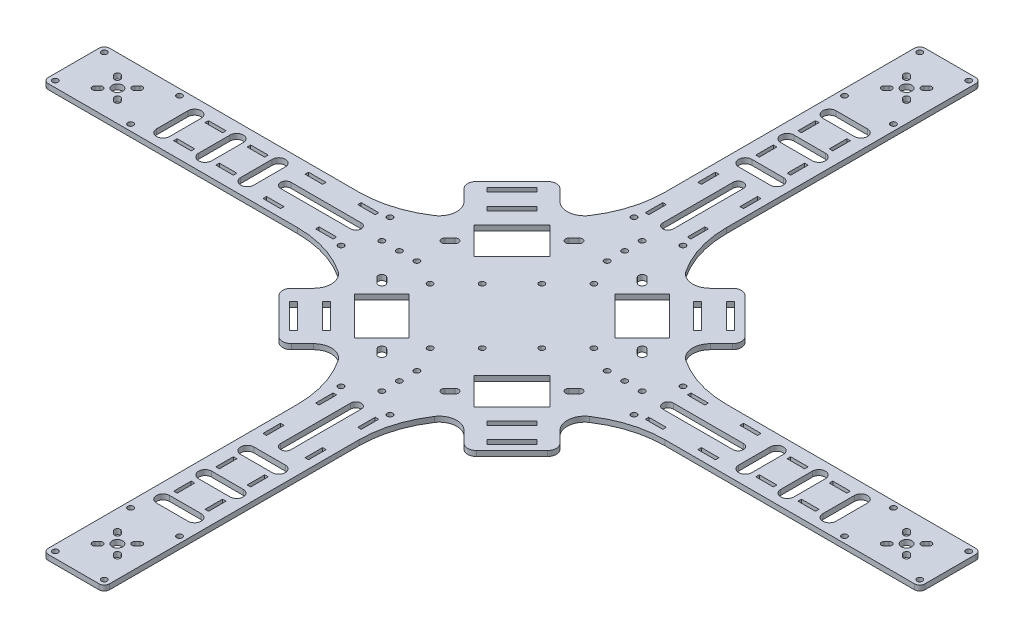
from build123d import *

# Parameters (mm, degrees)
SKETCH_234_R             = 1.6
SKETCH_234_R_2           = 3
SKETCH_234_W             = 2
SKETCH_234_H             = 10
SKETCH_234_W_2           = 10
SKETCH_234_H_2           = 2
EXTRUDE_1_DEPTH          = 3
CUT_EXTRUDE_1_DEPTH      = 537.78114721
CUT_EXTRUDE_1_DEPTH_BACK = 10
SKETCH_2_R               = 1.6
FILLET_1_R               = 3
FILLET_2_R               = 5
CUT_EXTRUDE_2_DEPTH      = 537.78114721
CUT_EXTRUDE_2_DEPTH_BACK = 10


with BuildPart() as part:
    # Sketch 234 → 凸台-拉伸1 (new body)
    with BuildSketch(Plane(origin=(0, 0, 0), x_dir=(1, 0, 0), z_dir=(0, 1, 0))):
        with BuildLine():
            Line((17.5, 25), (-17.5, 25))
            Line((-17.5, 25), (-17.5, -25))
            Line((-17.5, -25), (-17.5, -120.147186258))
            ThreePointArc((-17.5, -120.147186258), (-20.040144251, -137.420430809), (-27.445499244, -153.231124265))
            ThreePointArc((-27.445499244, -153.231124265), (-34.782826417, -157.666496127), (-42.858983849, -154.788202409))
            Line((-42.858983849, -154.788202409), (-52.751262658, -144.895923599))
            Line((-52.751262658, -144.895923599), (-80.104076401, -172.248737342))
            Line((-80.104076401, -172.248737342), (-70.211797591, -182.141016151))
            ThreePointArc((-70.211797591, -182.141016151), (-67.333503873, -190.217173583), (-71.768875735, -197.554500756))
            ThreePointArc((-71.768875735, -197.554500756), (-87.579569191, -204.959855749), (-104.852813742, -207.5))
            Line((-104.852813742, -207.5), (-200, -207.5))
            Line((-200, -207.5), (-250, -207.5))
            Line((-250, -207.5), (-250, -242.5))
            Line((-250, -242.5), (-200, -242.5))
            Line((-200, -242.5), (-104.852813742, -242.5))
            ThreePointArc((-104.852813742, -242.5), (-87.579569191, -245.040144251), (-71.768875735, -252.445499244))
            ThreePointArc((-71.768875735, -252.445499244), (-67.333503873, -259.782826417), (-70.211797591, -267.858983849))
            Line((-70.211797591, -267.858983849), (-80.104076401, -277.751262658))
            Line((-80.104076401, -277.751262658), (-52.751262658, -305.104076401))
            Line((-52.751262658, -305.104076401), (-42.858983849, -295.211797591))
            ThreePointArc((-42.858983849, -295.211797591), (-34.782826417, -292.333503873), (-27.445499244, -296.768875735))
            ThreePointArc((-27.445499244, -296.768875735), (-20.040144251, -312.579569191), (-17.5, -329.852813742))
            Line((-17.5, -329.852813742), (-17.5, -425))
            Line((-17.5, -425), (-17.5, -475))
            Line((-17.5, -475), (17.5, -475))
            Line((17.5, -475), (17.5, -425))
            Line((17.5, -425), (17.5, -329.852813742))
            ThreePointArc((17.5, -329.852813742), (20.040144251, -312.579569191), (27.445499244, -296.768875735))
            ThreePointArc((27.445499244, -296.768875735), (34.782826417, -292.333503873), (42.858983849, -295.211797591))
            Line((42.858983849, -295.211797591), (52.751262658, -305.104076401))
            Line((52.751262658, -305.104076401), (80.104076401, -277.751262658))
            Line((80.104076401, -277.751262658), (70.211797591, -267.858983849))
            ThreePointArc((70.211797591, -267.858983849), (67.333503873, -259.782826417), (71.768875735, -252.445499244))
            ThreePointArc((71.768875735, -252.445499244), (87.579569191, -245.040144251), (104.852813742, -242.5))
            Line((104.852813742, -242.5), (200, -242.5))
            Line((200, -242.5), (250, -242.5))
            Line((250, -242.5), (250, -207.5))
            Line((250, -207.5), (200, -207.5))
            Line((200, -207.5), (104.852813742, -207.5))
            ThreePointArc((104.852813742, -207.5), (87.579569191, -204.959855749), (71.768875735, -197.554500756))
            ThreePointArc((71.768875735, -197.554500756), (67.333503873, -190.217173583), (70.211797591, -182.141016151))
            Line((70.211797591, -182.141016151), (80.104076401, -172.248737342))
            Line((80.104076401, -172.248737342), (52.751262658, -144.895923599))
            Line((52.751262658, -144.895923599), (42.858983849, -154.788202409))
            ThreePointArc((42.858983849, -154.788202409), (34.782826417, -157.666496127), (27.445499244, -153.231124265))
            ThreePointArc((27.445499244, -153.231124265), (20.040144251, -137.420430809), (17.5, -120.147186258))
            Line((17.5, -120.147186258), (17.5, -25))
            Line((17.5, -25), (17.5, 25))
        make_face()
        with Locations((-13.964466094, -471.464466094)):
            Circle(SKETCH_234_R, mode=Mode.SUBTRACT)
        with BuildLine():
            ThreePointArc((-6.081118318, -453.818376618), (-3.818376618, -453.818376618), (-3.818376618, -456.081118318))
            Line((-3.818376618, -456.081118318), (-5.232590181, -457.495331881))
            ThreePointArc((-5.232590181, -457.495331881), (-7.495331881, -457.495331881), (-7.495331881, -455.232590181))
            Line((-7.495331881, -455.232590181), (-6.081118318, -453.818376618))
        make_face(mode=Mode.SUBTRACT)
        with Locations((0, -450)):
            Circle(SKETCH_234_R_2, mode=Mode.SUBTRACT)
        with BuildLine():
            ThreePointArc((-3.818376618, -443.918881682), (-3.818376618, -446.181623382), (-6.081118318, -446.181623382))
            Line((-6.081118318, -446.181623382), (-7.495331881, -444.767409819))
            ThreePointArc((-7.495331881, -444.767409819), (-7.495331881, -442.504668119), (-5.232590181, -442.504668119))
            Line((-5.232590181, -442.504668119), (-3.818376618, -443.918881682))
        make_face(mode=Mode.SUBTRACT)
        with Locations((-13.964466094, -428.535533906)):
            Circle(SKETCH_234_R, mode=Mode.SUBTRACT)
        with BuildLine():
            ThreePointArc((-9, -418.75), (-12.75, -415), (-9, -411.25))
            Line((-9, -411.25), (9, -411.25))
            ThreePointArc((9, -411.25), (12.75, -415), (9, -418.75))
            Line((9, -418.75), (0, -418.75))
            Line((0, -418.75), (-9, -418.75))
        make_face(mode=Mode.SUBTRACT)
        Polygon((-7.93903755, -408), (-9, -408), (-9.93903755, -408), (-9.93903755, -398), (-9, -398), (-7.93903755, -398), align=None, mode=Mode.SUBTRACT)
        with Locations((-8.93903755, -378.95882731)):
            Rectangle(SKETCH_234_W, SKETCH_234_H, mode=Mode.SUBTRACT)
        with BuildLine():
            ThreePointArc((-244.864466094, -238.964466094), (-245.852172602, -240.442673346), (-247.595836944, -240.095836944))
            ThreePointArc((-247.595836944, -240.095836944), (-247.076759586, -237.486258842), (-244.864466094, -238.964466094))
        make_face(mode=Mode.SUBTRACT)
        with BuildLine():
            ThreePointArc((-231.081118318, -228.818376618), (-228.818376618, -228.818376618), (-228.818376618, -231.081118318))
            Line((-228.818376618, -231.081118318), (-230.232590181, -232.495331881))
            ThreePointArc((-230.232590181, -232.495331881), (-232.495331881, -232.495331881), (-232.495331881, -230.232590181))
            Line((-232.495331881, -230.232590181), (-231.081118318, -228.818376618))
        make_face(mode=Mode.SUBTRACT)
        with BuildLine():
            ThreePointArc((-221.181623382, -231.081118318), (-221.181623382, -228.818376618), (-218.918881682, -228.818376618))
            Line((-218.918881682, -228.818376618), (-217.504668119, -230.232590181))
            ThreePointArc((-217.504668119, -230.232590181), (-217.504668119, -232.495331881), (-219.767409819, -232.495331881))
            Line((-219.767409819, -232.495331881), (-221.181623382, -231.081118318))
        make_face(mode=Mode.SUBTRACT)
        with Locations((-203.535533906, -238.964466094)):
            Circle(SKETCH_234_R, mode=Mode.SUBTRACT)
        with Locations((-178, -233.93903755)):
            Rectangle(SKETCH_234_W_2, SKETCH_234_H_2, mode=Mode.SUBTRACT)
        with Locations((-153.95882731, -233.93903755)):
            Rectangle(SKETCH_234_W_2, SKETCH_234_H_2, mode=Mode.SUBTRACT)
        with Locations((-12, -349)):
            Rectangle(SKETCH_234_W, SKETCH_234_H, mode=Mode.SUBTRACT)
        with Locations((-12, -319)):
            Rectangle(SKETCH_234_W, SKETCH_234_H, mode=Mode.SUBTRACT)
        with Locations((-13.964466094, -308.535533906)):
            Circle(SKETCH_234_R, mode=Mode.SUBTRACT)
        with Locations((-124, -237)):
            Rectangle(SKETCH_234_W_2, SKETCH_234_H_2, mode=Mode.SUBTRACT)
        with Locations((-94, -237)):
            Rectangle(SKETCH_234_W_2, SKETCH_234_H_2, mode=Mode.SUBTRACT)
        with BuildLine():
            ThreePointArc((-89, -222), (-86, -225), (-89, -228))
            Line((-89, -228), (-129, -228))
            ThreePointArc((-129, -228), (-132, -225), (-129, -222))
            Line((-129, -222), (-89, -222))
        make_face(mode=Mode.SUBTRACT)
        with Locations((-83.535533906, -238.964466094)):
            Circle(SKETCH_234_R, mode=Mode.SUBTRACT)
        with BuildLine():
            ThreePointArc((15.564466094, -471.464466094), (15.442673346, -472.076759586), (15.095836944, -472.595836944))
            ThreePointArc((15.095836944, -472.595836944), (12.486258842, -470.852172602), (15.564466094, -471.464466094))
        make_face(mode=Mode.SUBTRACT)
        with BuildLine():
            ThreePointArc((3.818376618, -456.081118318), (3.818376618, -453.818376618), (6.081118318, -453.818376618))
            Line((6.081118318, -453.818376618), (7.495331881, -455.232590181))
            ThreePointArc((7.495331881, -455.232590181), (7.495331881, -457.495331881), (5.232590181, -457.495331881))
            Line((5.232590181, -457.495331881), (3.818376618, -456.081118318))
        make_face(mode=Mode.SUBTRACT)
        with BuildLine():
            ThreePointArc((6.081118318, -446.181623382), (3.818376618, -446.181623382), (3.818376618, -443.918881682))
            Line((3.818376618, -443.918881682), (5.232590181, -442.504668119))
            ThreePointArc((5.232590181, -442.504668119), (7.495331881, -442.504668119), (7.495331881, -444.767409819))
            Line((7.495331881, -444.767409819), (6.081118318, -446.181623382))
        make_face(mode=Mode.SUBTRACT)
        with Locations((13.964466094, -428.535533906)):
            Circle(SKETCH_234_R, mode=Mode.SUBTRACT)
        with Locations((8.93903755, -403)):
            Rectangle(SKETCH_234_W, SKETCH_234_H, mode=Mode.SUBTRACT)
        with BuildLine():
            Line((9, -394.75), (-9, -394.75))
            ThreePointArc((-9, -394.75), (-12.75, -391), (-9, -387.25))
            Line((-9, -387.25), (9, -387.25))
            ThreePointArc((9, -387.25), (12.75, -391), (9, -394.75))
        make_face(mode=Mode.SUBTRACT)
        with Locations((8.93903755, -378.95882731)):
            Rectangle(SKETCH_234_W, SKETCH_234_H, mode=Mode.SUBTRACT)
        with BuildLine():
            ThreePointArc((9, -363.25), (12.75, -367), (9, -370.75))
            Line((9, -370.75), (-9, -370.75))
            ThreePointArc((-9, -370.75), (-12.75, -367), (-9, -363.25))
            Line((-9, -363.25), (9, -363.25))
        make_face(mode=Mode.SUBTRACT)
        with Locations((12, -349)):
            Rectangle(SKETCH_234_W, SKETCH_234_H, mode=Mode.SUBTRACT)
        with BuildLine():
            ThreePointArc((-3, -314), (0, -311), (3, -314))
            Line((3, -314), (3, -354))
            ThreePointArc((3, -354), (0, -357), (-3, -354))
            Line((-3, -354), (-3, -314))
        make_face(mode=Mode.SUBTRACT)
        with Locations((12, -319)):
            Rectangle(SKETCH_234_W, SKETCH_234_H, mode=Mode.SUBTRACT)
        with Locations((13.964466094, -308.535533906)):
            Circle(SKETCH_234_R, mode=Mode.SUBTRACT)
        with Locations((83.535533906, -238.964466094)):
            Circle(SKETCH_234_R, mode=Mode.SUBTRACT)
        with Locations((94, -237)):
            Rectangle(SKETCH_234_W_2, SKETCH_234_H_2, mode=Mode.SUBTRACT)
        with Locations((124, -237)):
            Rectangle(SKETCH_234_W_2, SKETCH_234_H_2, mode=Mode.SUBTRACT)
        with Locations((153.95882731, -233.93903755)):
            Rectangle(SKETCH_234_W_2, SKETCH_234_H_2, mode=Mode.SUBTRACT)
        Polygon((183, -232.93903755), (183, -234), (183, -234.93903755), (173, -234.93903755), (173, -234), (173, -232.93903755), align=None, mode=Mode.SUBTRACT)
        with Locations((203.535533906, -238.964466094)):
            Circle(SKETCH_234_R, mode=Mode.SUBTRACT)
        with BuildLine():
            ThreePointArc((218.918881682, -228.818376618), (221.181623382, -228.818376618), (221.181623382, -231.081118318))
            Line((221.181623382, -231.081118318), (219.767409819, -232.495331881))
            ThreePointArc((219.767409819, -232.495331881), (217.504668119, -232.495331881), (217.504668119, -230.232590181))
            Line((217.504668119, -230.232590181), (218.918881682, -228.818376618))
        make_face(mode=Mode.SUBTRACT)
        with BuildLine():
            ThreePointArc((228.818376618, -231.081118318), (228.818376618, -228.818376618), (231.081118318, -228.818376618))
            Line((231.081118318, -228.818376618), (232.495331881, -230.232590181))
            ThreePointArc((232.495331881, -230.232590181), (232.495331881, -232.495331881), (230.232590181, -232.495331881))
            Line((230.232590181, -232.495331881), (228.818376618, -231.081118318))
        make_face(mode=Mode.SUBTRACT)
        with Locations((246.464466094, -238.964466094)):
            Circle(SKETCH_234_R, mode=Mode.SUBTRACT)
        with Locations((-246.464466094, -211.035533906)):
            Circle(SKETCH_234_R, mode=Mode.SUBTRACT)
        with BuildLine():
            ThreePointArc((-228.818376618, -218.918881682), (-228.818376618, -221.181623382), (-231.081118318, -221.181623382))
            Line((-231.081118318, -221.181623382), (-232.495331881, -219.767409819))
            ThreePointArc((-232.495331881, -219.767409819), (-232.495331881, -217.504668119), (-230.232590181, -217.504668119))
            Line((-230.232590181, -217.504668119), (-228.818376618, -218.918881682))
        make_face(mode=Mode.SUBTRACT)
        with Locations((-225, -225)):
            Circle(SKETCH_234_R_2, mode=Mode.SUBTRACT)
        with BuildLine():
            ThreePointArc((-218.918881682, -221.181623382), (-221.181623382, -221.181623382), (-221.181623382, -218.918881682))
            Line((-221.181623382, -218.918881682), (-219.767409819, -217.504668119))
            ThreePointArc((-219.767409819, -217.504668119), (-217.504668119, -217.504668119), (-217.504668119, -219.767409819))
            Line((-217.504668119, -219.767409819), (-218.918881682, -221.181623382))
        make_face(mode=Mode.SUBTRACT)
        with Locations((-203.535533906, -211.035533906)):
            Circle(SKETCH_234_R, mode=Mode.SUBTRACT)
        with BuildLine():
            ThreePointArc((-193.75, -216), (-190, -212.25), (-186.25, -216))
            Line((-186.25, -216), (-186.25, -234))
            ThreePointArc((-186.25, -234), (-190, -237.75), (-193.75, -234))
            Line((-193.75, -234), (-193.75, -225))
            Line((-193.75, -225), (-193.75, -216))
        make_face(mode=Mode.SUBTRACT)
        Polygon((-183, -217.06096245), (-183, -216), (-183, -215.06096245), (-173, -215.06096245), (-173, -216), (-173, -217.06096245), align=None, mode=Mode.SUBTRACT)
        with BuildLine():
            Line((-169.75, -234), (-169.75, -216))
            ThreePointArc((-169.75, -216), (-166, -212.25), (-162.25, -216))
            Line((-162.25, -216), (-162.25, -234))
            ThreePointArc((-162.25, -234), (-166, -237.75), (-169.75, -234))
        make_face(mode=Mode.SUBTRACT)
        with BuildLine():
            ThreePointArc((-138.25, -234), (-142, -237.75), (-145.75, -234))
            Line((-145.75, -234), (-145.75, -216))
            ThreePointArc((-145.75, -216), (-142, -212.25), (-138.25, -216))
            Line((-138.25, -216), (-138.25, -234))
        make_face(mode=Mode.SUBTRACT)
        with Locations((-153.95882731, -216.06096245)):
            Rectangle(SKETCH_234_W_2, SKETCH_234_H_2, mode=Mode.SUBTRACT)
        with Locations((-124, -213)):
            Rectangle(SKETCH_234_W_2, SKETCH_234_H_2, mode=Mode.SUBTRACT)
        with Locations((-94, -213)):
            Rectangle(SKETCH_234_W_2, SKETCH_234_H_2, mode=Mode.SUBTRACT)
        with Locations((-83.535533906, -211.035533906)):
            Circle(SKETCH_234_R, mode=Mode.SUBTRACT)
        with Locations((-13.964466094, -141.464466094)):
            Circle(SKETCH_234_R, mode=Mode.SUBTRACT)
        with Locations((-12, -131)):
            Rectangle(SKETCH_234_W, SKETCH_234_H, mode=Mode.SUBTRACT)
        with BuildLine():
            ThreePointArc((3, -136), (0, -139), (-3, -136))
            Line((-3, -136), (-3, -96))
            ThreePointArc((-3, -96), (0, -93), (3, -96))
            Line((3, -96), (3, -136))
        make_face(mode=Mode.SUBTRACT)
        with Locations((-12, -101)):
            Rectangle(SKETCH_234_W, SKETCH_234_H, mode=Mode.SUBTRACT)
        with BuildLine():
            ThreePointArc((-9, -86.75), (-12.75, -83), (-9, -79.25))
            Line((-9, -79.25), (9, -79.25))
            ThreePointArc((9, -79.25), (12.75, -83), (9, -86.75))
            Line((9, -86.75), (-9, -86.75))
        make_face(mode=Mode.SUBTRACT)
        with Locations((-8.93903755, -71.04117269)):
            Rectangle(SKETCH_234_W, SKETCH_234_H, mode=Mode.SUBTRACT)
        with BuildLine():
            Line((-9, -55.25), (9, -55.25))
            ThreePointArc((9, -55.25), (12.75, -59), (9, -62.75))
            Line((9, -62.75), (-9, -62.75))
            ThreePointArc((-9, -62.75), (-12.75, -59), (-9, -55.25))
        make_face(mode=Mode.SUBTRACT)
        with Locations((-8.93903755, -47)):
            Rectangle(SKETCH_234_W, SKETCH_234_H, mode=Mode.SUBTRACT)
        with BuildLine():
            ThreePointArc((-9, -38.75), (-12.75, -35), (-9, -31.25))
            Line((-9, -31.25), (0, -31.25))
            Line((0, -31.25), (9, -31.25))
            ThreePointArc((9, -31.25), (12.75, -35), (9, -38.75))
            Line((9, -38.75), (-9, -38.75))
        make_face(mode=Mode.SUBTRACT)
        with Locations((-13.964466094, -21.464466094)):
            Circle(SKETCH_234_R, mode=Mode.SUBTRACT)
        with BuildLine():
            ThreePointArc((-6.081118318, -3.818376618), (-3.818376618, -3.818376618), (-3.818376618, -6.081118318))
            Line((-3.818376618, -6.081118318), (-5.232590181, -7.495331881))
            ThreePointArc((-5.232590181, -7.495331881), (-7.495331881, -7.495331881), (-7.495331881, -5.232590181))
            Line((-7.495331881, -5.232590181), (-6.081118318, -3.818376618))
        make_face(mode=Mode.SUBTRACT)
        Circle(SKETCH_234_R_2, mode=Mode.SUBTRACT)
        with BuildLine():
            ThreePointArc((-3.818376618, 6.081118318), (-3.818376618, 3.818376618), (-6.081118318, 3.818376618))
            Line((-6.081118318, 3.818376618), (-7.495331881, 5.232590181))
            ThreePointArc((-7.495331881, 5.232590181), (-7.495331881, 7.495331881), (-5.232590181, 7.495331881))
            Line((-5.232590181, 7.495331881), (-3.818376618, 6.081118318))
        make_face(mode=Mode.SUBTRACT)
        with BuildLine():
            ThreePointArc((-12.364466094, 21.464466094), (-14.576759586, 19.986258842), (-15.095836944, 22.595836944))
            ThreePointArc((-15.095836944, 22.595836944), (-13.352172602, 22.942673346), (-12.364466094, 21.464466094))
        make_face(mode=Mode.SUBTRACT)
        with Locations((83.535533906, -211.035533906)):
            Circle(SKETCH_234_R, mode=Mode.SUBTRACT)
        with BuildLine():
            ThreePointArc((89, -228), (86, -225), (89, -222))
            Line((89, -222), (129, -222))
            ThreePointArc((129, -222), (132, -225), (129, -228))
            Line((129, -228), (89, -228))
        make_face(mode=Mode.SUBTRACT)
        with Locations((94, -213)):
            Rectangle(SKETCH_234_W_2, SKETCH_234_H_2, mode=Mode.SUBTRACT)
        with Locations((124, -213)):
            Rectangle(SKETCH_234_W_2, SKETCH_234_H_2, mode=Mode.SUBTRACT)
        with Locations((13.964466094, -141.464466094)):
            Circle(SKETCH_234_R, mode=Mode.SUBTRACT)
        with Locations((12, -131)):
            Rectangle(SKETCH_234_W, SKETCH_234_H, mode=Mode.SUBTRACT)
        with Locations((12, -101)):
            Rectangle(SKETCH_234_W, SKETCH_234_H, mode=Mode.SUBTRACT)
        with BuildLine():
            ThreePointArc((138.25, -216), (142, -212.25), (145.75, -216))
            Line((145.75, -216), (145.75, -234))
            ThreePointArc((145.75, -234), (142, -237.75), (138.25, -234))
            Line((138.25, -234), (138.25, -216))
        make_face(mode=Mode.SUBTRACT)
        with Locations((153.95882731, -216.06096245)):
            Rectangle(SKETCH_234_W_2, SKETCH_234_H_2, mode=Mode.SUBTRACT)
        with BuildLine():
            Line((169.75, -216), (169.75, -234))
            ThreePointArc((169.75, -234), (166, -237.75), (162.25, -234))
            Line((162.25, -234), (162.25, -216))
            ThreePointArc((162.25, -216), (166, -212.25), (169.75, -216))
        make_face(mode=Mode.SUBTRACT)
        with Locations((178, -216.06096245)):
            Rectangle(SKETCH_234_W_2, SKETCH_234_H_2, mode=Mode.SUBTRACT)
        with BuildLine():
            ThreePointArc((193.75, -234), (190, -237.75), (186.25, -234))
            Line((186.25, -234), (186.25, -216))
            ThreePointArc((186.25, -216), (190, -212.25), (193.75, -216))
            Line((193.75, -216), (193.75, -225))
            Line((193.75, -225), (193.75, -234))
        make_face(mode=Mode.SUBTRACT)
        with Locations((203.535533906, -211.035533906)):
            Circle(SKETCH_234_R, mode=Mode.SUBTRACT)
        with Locations((225, -225)):
            Circle(SKETCH_234_R_2, mode=Mode.SUBTRACT)
        with BuildLine():
            ThreePointArc((221.181623382, -218.918881682), (221.181623382, -221.181623382), (218.918881682, -221.181623382))
            Line((218.918881682, -221.181623382), (217.504668119, -219.767409819))
            ThreePointArc((217.504668119, -219.767409819), (217.504668119, -217.504668119), (219.767409819, -217.504668119))
            Line((219.767409819, -217.504668119), (221.181623382, -218.918881682))
        make_face(mode=Mode.SUBTRACT)
        with BuildLine():
            ThreePointArc((231.081118318, -221.181623382), (228.818376618, -221.181623382), (228.818376618, -218.918881682))
            Line((228.818376618, -218.918881682), (230.232590181, -217.504668119))
            ThreePointArc((230.232590181, -217.504668119), (232.495331881, -217.504668119), (232.495331881, -219.767409819))
            Line((232.495331881, -219.767409819), (231.081118318, -221.181623382))
        make_face(mode=Mode.SUBTRACT)
        with BuildLine():
            ThreePointArc((248.064466094, -211.035533906), (244.986258842, -211.647827398), (247.595836944, -209.904163056))
            ThreePointArc((247.595836944, -209.904163056), (247.942673346, -210.423240414), (248.064466094, -211.035533906))
        make_face(mode=Mode.SUBTRACT)
        with Locations((8.93903755, -71.04117269)):
            Rectangle(SKETCH_234_W, SKETCH_234_H, mode=Mode.SUBTRACT)
        Polygon((7.93903755, -42), (9, -42), (9.93903755, -42), (9.93903755, -52), (9, -52), (7.93903755, -52), align=None, mode=Mode.SUBTRACT)
        with Locations((13.964466094, -21.464466094)):
            Circle(SKETCH_234_R, mode=Mode.SUBTRACT)
        with BuildLine():
            ThreePointArc((3.818376618, -6.081118318), (3.818376618, -3.818376618), (6.081118318, -3.818376618))
            Line((6.081118318, -3.818376618), (7.495331881, -5.232590181))
            ThreePointArc((7.495331881, -5.232590181), (7.495331881, -7.495331881), (5.232590181, -7.495331881))
            Line((5.232590181, -7.495331881), (3.818376618, -6.081118318))
        make_face(mode=Mode.SUBTRACT)
        with BuildLine():
            ThreePointArc((6.081118318, 3.818376618), (3.818376618, 3.818376618), (3.818376618, 6.081118318))
            Line((3.818376618, 6.081118318), (5.232590181, 7.495331881))
            ThreePointArc((5.232590181, 7.495331881), (7.495331881, 7.495331881), (7.495331881, 5.232590181))
            Line((7.495331881, 5.232590181), (6.081118318, 3.818376618))
        make_face(mode=Mode.SUBTRACT)
        with Locations((13.964466094, 21.464466094)):
            Circle(SKETCH_234_R, mode=Mode.SUBTRACT)
    extrude(amount=EXTRUDE_1_DEPTH)

    # 草图2 → 切除-拉伸1 (cut, two sides: drawn at the far end of the back side and taken through both)
    with BuildSketch(Plane(origin=(0, 3, 0), x_dir=(1, 0, 0), z_dir=(0, 1, 0)).offset(-CUT_EXTRUDE_1_DEPTH_BACK)):
        Polygon((40.128309832, -243.561553006), (29.344931419, -254.344931419), (18.561553006, -265.128309832), (34.117902192, -280.684659018), (55.684659018, -259.117902192), align=None)
        with Locations((7.424621202, -185.755573644)):
            Circle(SKETCH_2_R)
        with Locations((39.244426356, -217.575378798)):
            Circle(SKETCH_2_R)
        with BuildLine():
            Line((54.800775542, -247.273863607), (57.629202667, -244.445436483))
            ThreePointArc((57.629202667, -244.445436483), (57.629202667, -241.617009358), (54.800775542, -241.617009358))
            Line((54.800775542, -241.617009358), (51.972348417, -244.445436483))
            ThreePointArc((51.972348417, -244.445436483), (51.972348417, -247.273863607), (54.800775542, -247.273863607))
        make_face()
        with BuildLine():
            ThreePointArc((16.617009358, -279.800775542), (16.617009358, -282.629202667), (19.445436483, -282.629202667))
            Line((19.445436483, -282.629202667), (22.273863607, -279.800775542))
            ThreePointArc((22.273863607, -279.800775542), (22.273863607, -276.972348417), (19.445436483, -276.972348417))
            Line((19.445436483, -276.972348417), (16.617009358, -279.800775542))
        make_face()
        with BuildLine():
            Line((-22.273863607, -279.800775542), (-19.445436483, -282.629202667))
            ThreePointArc((-19.445436483, -282.629202667), (-16.617009358, -282.629202667), (-16.617009358, -279.800775542))
            Line((-16.617009358, -279.800775542), (-19.445436483, -276.972348417))
            ThreePointArc((-19.445436483, -276.972348417), (-22.273863607, -276.972348417), (-22.273863607, -279.800775542))
        make_face()
        with BuildLine():
            ThreePointArc((-54.800775542, -241.617009358), (-57.629202667, -241.617009358), (-57.629202667, -244.445436483))
            Line((-57.629202667, -244.445436483), (-54.800775542, -247.273863607))
            ThreePointArc((-54.800775542, -247.273863607), (-51.972348417, -247.273863607), (-51.972348417, -244.445436483))
            Line((-51.972348417, -244.445436483), (-54.800775542, -241.617009358))
        make_face()
        with BuildLine():
            Line((-54.800775542, -202.726136393), (-57.629202667, -205.554563517))
            ThreePointArc((-57.629202667, -205.554563517), (-57.629202667, -208.382990642), (-54.800775542, -208.382990642))
            Line((-54.800775542, -208.382990642), (-51.972348417, -205.554563517))
            ThreePointArc((-51.972348417, -205.554563517), (-51.972348417, -202.726136393), (-54.800775542, -202.726136393))
        make_face()
        with BuildLine():
            ThreePointArc((-16.617009358, -170.199224458), (-16.617009358, -167.370797333), (-19.445436483, -167.370797333))
            Line((-19.445436483, -167.370797333), (-22.273863607, -170.199224458))
            ThreePointArc((-22.273863607, -170.199224458), (-22.273863607, -173.027651583), (-19.445436483, -173.027651583))
            Line((-19.445436483, -173.027651583), (-16.617009358, -170.199224458))
        make_face()
        with BuildLine():
            Line((22.273863607, -170.199224458), (19.445436483, -167.370797333))
            ThreePointArc((19.445436483, -167.370797333), (16.617009358, -167.370797333), (16.617009358, -170.199224458))
            Line((16.617009358, -170.199224458), (19.445436483, -173.027651583))
            ThreePointArc((19.445436483, -173.027651583), (22.273863607, -173.027651583), (22.273863607, -170.199224458))
        make_face()
        with BuildLine():
            ThreePointArc((54.800775542, -208.382990642), (57.629202667, -208.382990642), (57.629202667, -205.554563517))
            Line((57.629202667, -205.554563517), (54.800775542, -202.726136393))
            ThreePointArc((54.800775542, -202.726136393), (51.972348417, -202.726136393), (51.972348417, -205.554563517))
            Line((51.972348417, -205.554563517), (54.800775542, -208.382990642))
        make_face()
        Polygon((-18.561553006, -265.128309832), (-40.128309832, -243.561553006), (-55.684659018, -259.117902192), (-34.117902192, -280.684659018), align=None)
        Polygon((-40.128309832, -206.438446994), (-18.561553006, -184.871690168), (-34.117902192, -169.315340982), (-55.684659018, -190.882097808), align=None)
        Polygon((18.561553006, -184.871690168), (40.128309832, -206.438446994), (55.684659018, -190.882097808), (34.117902192, -169.315340982), align=None)
        with Locations((7.424621202, -249.395183951)):
            Circle(SKETCH_2_R)
        with Locations((-24.395183951, -217.575378798)):
            Circle(SKETCH_2_R)
        with Locations((24.395183951, -232.424621202)):
            Circle(SKETCH_2_R)
        with Locations((-7.424621202, -264.244426356)):
            Circle(SKETCH_2_R)
        with Locations((-39.244426356, -232.424621202)):
            Circle(SKETCH_2_R)
        with Locations((-7.424621202, -200.604816049)):
            Circle(SKETCH_2_R)
        with Locations((0, -150.753787975)):
            Circle(SKETCH_2_R)
        with Locations((0, -160.753787975)):
            Circle(SKETCH_2_R)
        with Locations((0, -170.753787975)):
            Circle(SKETCH_2_R)
        with Locations((74.246212025, -225)):
            Circle(SKETCH_2_R)
        with Locations((64.246212025, -225)):
            Circle(SKETCH_2_R)
        with Locations((54.246212025, -225)):
            Circle(SKETCH_2_R)
        with Locations((0, -299.246212025)):
            Circle(SKETCH_2_R)
        with Locations((0, -289.246212025)):
            Circle(SKETCH_2_R)
        with Locations((0, -279.246212025)):
            Circle(SKETCH_2_R)
        with Locations((-74.246212025, -225)):
            Circle(SKETCH_2_R)
        with Locations((-64.246212025, -225)):
            Circle(SKETCH_2_R)
        with Locations((-54.246212025, -225)):
            Circle(SKETCH_2_R)
    extrude(amount=CUT_EXTRUDE_1_DEPTH + CUT_EXTRUDE_1_DEPTH_BACK, mode=Mode.SUBTRACT)

    # 圆角1
    fillet_1_edges = [part.edges().sort_by_distance(p)[0] for p in [
        (-250, 1.5, 242.5),
        (-250, 1.5, 207.5),
        (250, 1.5, 242.5),
        (250, 1.5, 207.5),
        (-17.5, 1.5, -25),
        (17.5, 1.5, -25),
        (17.5, 1.5, 475),
        (-17.5, 1.5, 475),
    ]]
    fillet(fillet_1_edges, radius=FILLET_1_R)

    # 圆角2
    fillet_2_edges = [part.edges().sort_by_distance(p)[0] for p in [
        (-80.104076401, 1.5, 172.248737342),
        (-52.751262658, 1.5, 144.895923599),
        (52.751262658, 1.5, 144.895923599),
        (80.104076401, 1.5, 172.248737342),
        (80.104076401, 1.5, 277.751262658),
        (52.751262658, 1.5, 305.104076401),
        (-52.751262658, 1.5, 305.104076401),
        (-80.104076401, 1.5, 277.751262658),
    ]]
    fillet(fillet_2_edges, radius=FILLET_2_R)

    # 草图2<3> → 切除-拉伸2 (cut, two sides: drawn at the far end of the back side and taken through both)
    with BuildSketch(Plane(origin=(0, 3, 0), x_dir=(1, 0, 0), z_dir=(0, 1, 0)).offset(-CUT_EXTRUDE_2_DEPTH_BACK)):
        Polygon((-46.982233047, -163.875631329), (-61.124368671, -178.017766953), (-58.861626971, -180.280508653), (-44.719491347, -166.138373029), align=None)
        Polygon((-54.053300859, -156.804563517), (-56.316042559, -154.541821818), (-70.458178182, -168.683957441), (-68.195436483, -170.946699141), align=None)
        Polygon((68.195436483, -170.946699141), (70.458178182, -168.683957441), (56.316042559, -154.541821818), (54.053300859, -156.804563517), align=None)
        Polygon((46.982233047, -163.875631329), (44.719491347, -166.138373029), (58.861626971, -180.280508653), (61.124368671, -178.017766953), align=None)
        Polygon((54.053300859, -293.195436483), (56.316042559, -295.458178182), (70.458178182, -281.316042559), (68.195436483, -279.053300859), align=None)
        Polygon((61.124368671, -271.982233047), (58.861626971, -269.719491347), (44.719491347, -283.861626971), (46.982233047, -286.124368671), align=None)
        Polygon((-68.195436483, -279.053300859), (-70.458178182, -281.316042559), (-56.316042559, -295.458178182), (-54.053300859, -293.195436483), align=None)
        Polygon((-46.982233047, -286.124368671), (-44.719491347, -283.861626971), (-58.861626971, -269.719491347), (-61.124368671, -271.982233047), align=None)
    extrude(amount=CUT_EXTRUDE_2_DEPTH + CUT_EXTRUDE_2_DEPTH_BACK, mode=Mode.SUBTRACT)


solid = part.part
